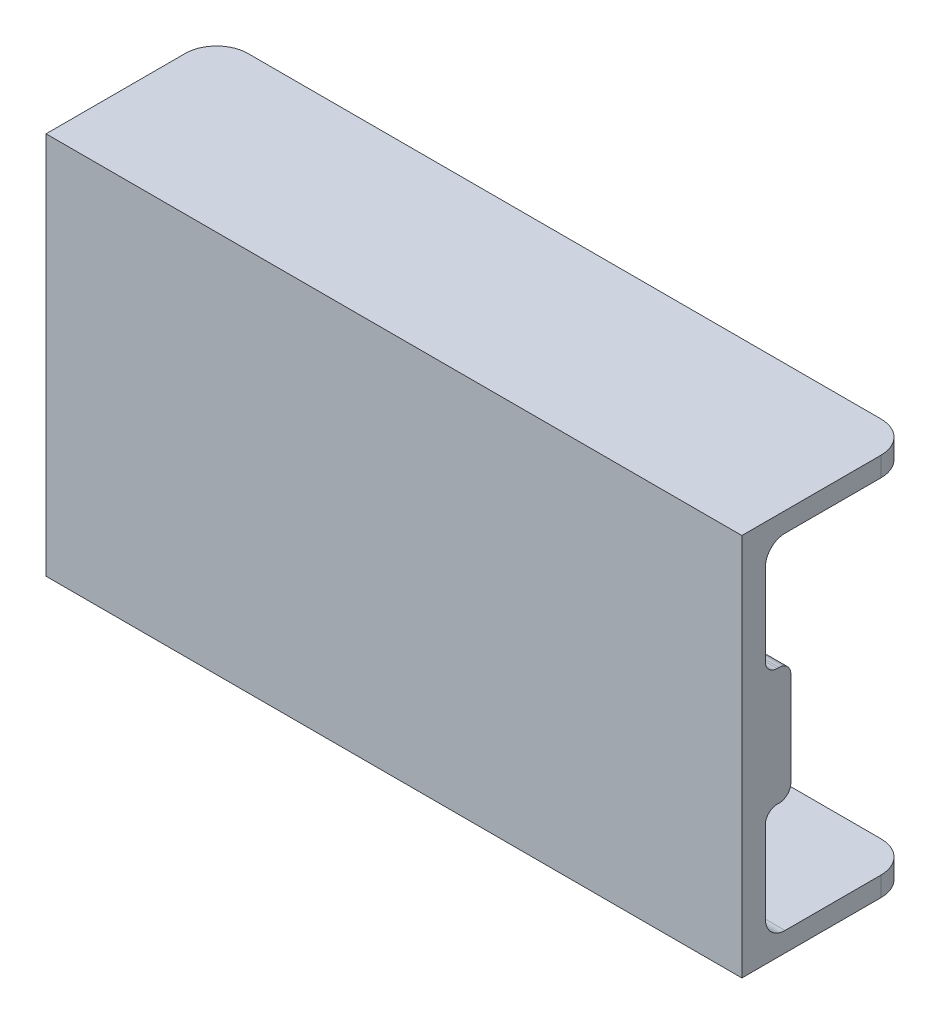
from build123d import *

# Parameters (mm, degrees)
SKETCH1_W           = 35.5
SKETCH1_H           = 19.55
BOSS_EXTRUDE1_DEPTH = 1.2
SKETCH2_W           = 35.5
SKETCH2_H           = 1
BOSS_EXTRUDE2_DEPTH = 7.5
FILLET1_R           = 1
SKETCH3_W           = 1
SKETCH3_H           = 6
BOSS_EXTRUDE3_DEPTH = 1.3
FILLET2_R           = 0.6
FILLET3_R           = 1.6


with BuildPart() as part:
    # Sketch1 → Boss-Extrude1 (new body)
    with BuildSketch(Plane.XY):
        Rectangle(SKETCH1_W, SKETCH1_H)
    extrude(amount=BOSS_EXTRUDE1_DEPTH)

    # Sketch2 → Boss-Extrude2 (add)
    with BuildSketch(Plane(origin=(0, 0, 0), x_dir=(-1, 0, 0), z_dir=(0, 0, -1))):
        with Locations((0, 9.275)):
            Rectangle(SKETCH2_W, SKETCH2_H)
        with Locations((0, -9.275)):
            Rectangle(SKETCH2_W, SKETCH2_H)
    extrude(amount=BOSS_EXTRUDE2_DEPTH)

    # Fillet1
    fillet1_edges = [part.edges().sort_by_distance(p)[0] for p in [
        (0, 8.775, 0),
        (0, -8.775, 0),
    ]]
    fillet(fillet1_edges, radius=FILLET1_R)

    # Sketch3 → Boss-Extrude3 (add)
    with BuildSketch(Plane(origin=(0, 0, 0), x_dir=(-1, 0, 0), z_dir=(0, 0, -1))):
        with Locations((17.25, 0)):
            Rectangle(SKETCH3_W, SKETCH3_H)
        with Locations((-17.25, 0)):
            Rectangle(SKETCH3_W, SKETCH3_H)
    extrude(amount=BOSS_EXTRUDE3_DEPTH)

    # Fillet2
    fillet2_edges = [part.edges().sort_by_distance(p)[0] for p in [
        (-17.25, 3, 0),
        (-17.25, -3, 0),
        (-17.25, 3, -1.3),
        (-17.25, -3, -1.3),
        (17.25, 3, 0),
        (17.25, -3, 0),
        (17.25, 3, -1.3),
        (17.25, -3, -1.3),
    ]]
    fillet(fillet2_edges, radius=FILLET2_R)

    # Fillet3
    fillet3_edges = [part.edges().sort_by_distance(p)[0] for p in [
        (17.75, 9.275, -7.5),
        (-17.75, 9.275, -7.5),
        (17.75, -9.275, -7.5),
        (-17.75, -9.275, -7.5),
    ]]
    fillet(fillet3_edges, radius=FILLET3_R)


solid = part.part
